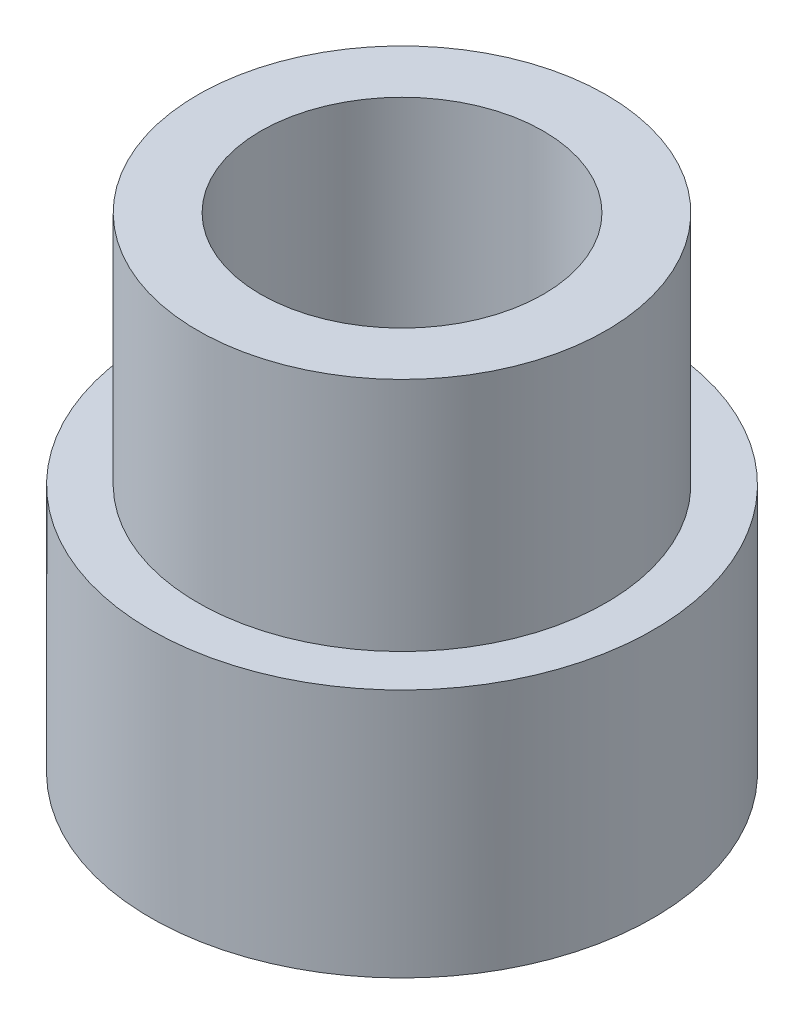
from build123d import *

# Parameters (mm, degrees)
SKETCH1_R           = 20.32
SKETCH1_R_2         = 4.6355
BOSS_EXTRUDE1_DEPTH = 10
SKETCH2_R           = 16.51
SKETCH2_R_2         = 11.43
BOSS_EXTRUDE2_DEPTH = 19.05
BOSS_EXTRUDE3_START = 10.16
SKETCH3_R           = 20.32
SKETCH3_R_2         = 4.6355
BOSS_EXTRUDE3_DEPTH = 10.16
CUT_EXTRUDE1_START  = -12
SKETCH4_R           = 11.43
CUT_EXTRUDE1_DEPTH  = 12
SKETCH6_R           = 11.25
CUT_EXTRUDE3_DEPTH  = 6.5
SKETCH7_R           = 8.5
CUT_EXTRUDE4_DEPTH  = 0.75


with BuildPart() as part:
    # Sketch1 → Boss-Extrude1 (new body)
    with BuildSketch(Plane(origin=(0, 0, 0), x_dir=(1, 0, 0), z_dir=(0, 1, 0))):
        with Locations(Location((0, 0, 0), (0, 0, 270))):
            Circle(SKETCH1_R)
        with Locations(Location((0, 0, 0), (0, 0, 270))):
            Circle(SKETCH1_R_2, mode=Mode.SUBTRACT)
    extrude(amount=BOSS_EXTRUDE1_DEPTH)

    # Sketch2 → Boss-Extrude2 (add)
    with BuildSketch(Plane(origin=(0, 10, 0), x_dir=(1, 0, 0), z_dir=(0, 1, 0))):
        with Locations(Location((0, 0, 0), (0, 0, 90))):
            Circle(SKETCH2_R)
        with Locations(Location((0, 0, 0), (0, 0, 90))):
            Circle(SKETCH2_R_2, mode=Mode.SUBTRACT)
    extrude(amount=BOSS_EXTRUDE2_DEPTH)

    # Sketch3 → Boss-Extrude3 (add)
    with BuildSketch(Plane(origin=(0, 0, 0), x_dir=(-1, 0, 0), z_dir=(0, -1, 0)).offset(BOSS_EXTRUDE3_START)):
        with Locations(Location((0, 0, 0), (0, 0, 90))):
            Circle(SKETCH3_R)
        with Locations(Location((0, 0, 0), (0, 0, 90))):
            Circle(SKETCH3_R_2, mode=Mode.SUBTRACT)
    extrude(amount=-BOSS_EXTRUDE3_DEPTH)

    # Sketch4 → Cut-Extrude1 (cut)
    with BuildSketch(Plane(origin=(0, 10, 0), x_dir=(1, 0, 0), z_dir=(0, 1, 0)).offset(CUT_EXTRUDE1_START)):
        with Locations(Location((0, 0, 0), (0, 0, 90))):
            Circle(SKETCH4_R)
    extrude(amount=CUT_EXTRUDE1_DEPTH, mode=Mode.SUBTRACT)

    # Sketch6 → Cut-Extrude3 (cut)
    with BuildSketch(Plane.XZ.offset(10.16)):
        with Locations(Location((0, 0, 0), (0, 0, 270))):
            Circle(SKETCH6_R)
    extrude(amount=-CUT_EXTRUDE3_DEPTH, mode=Mode.SUBTRACT)

    # Sketch7 → Cut-Extrude4 (cut)
    with BuildSketch(Plane(origin=(0, -3.66, 0), x_dir=(-1, 0, 0), z_dir=(0, -1, 0))):
        with Locations(Location((0, 0, 0), (0, 0, 90))):
            Circle(SKETCH7_R)
    extrude(amount=-CUT_EXTRUDE4_DEPTH, mode=Mode.SUBTRACT)


solid = part.part
